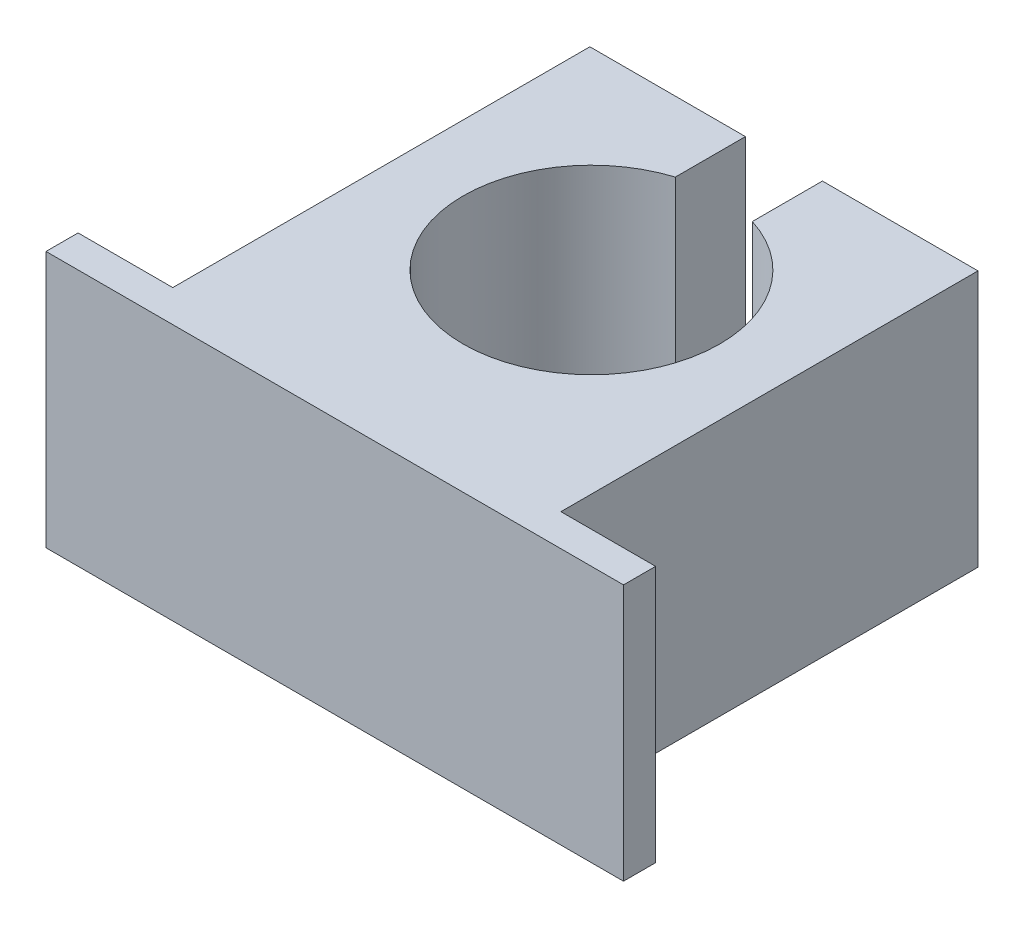
from build123d import *

# Parameters (mm, degrees)
SKETCH1_W           = 90
SKETCH1_H           = 70
BOSS_EXTRUDE1_DEPTH = 40
SKETCH4_R           = 20
CUT_EXTRUDE1_DEPTH  = 40
SKETCH5_W           = 14.755351209
SKETCH5_H           = 65
CUT_EXTRUDE2_DEPTH  = 40
SKETCH6_W           = 12
SKETCH6_H           = 27.02325336
CUT_EXTRUDE3_DEPTH  = 40


with BuildPart() as part:
    # Sketch1 → Boss-Extrude1 (new body)
    with BuildSketch(Plane(origin=(0, 0, 0), x_dir=(1, 0, 0), z_dir=(0, 1, 0))):
        Rectangle(SKETCH1_W, SKETCH1_H)
    extrude(amount=BOSS_EXTRUDE1_DEPTH)

    # Sketch4 → Cut-Extrude1 (cut)
    with BuildSketch(Plane(origin=(0, 40, 0), x_dir=(1, 0, 0), z_dir=(0, 1, 0))):
        with Locations(Location((0, 5, 0), (0, 0, 270))):
            Circle(SKETCH4_R)
    extrude(amount=-CUT_EXTRUDE1_DEPTH, mode=Mode.SUBTRACT)

    # Sketch5 → Cut-Extrude2 (cut)
    with BuildSketch(Plane(origin=(0, 40, 0), x_dir=(1, 0, 0), z_dir=(0, 1, 0))):
        with Locations((-37.622324396, 2.5)):
            Rectangle(SKETCH5_W, SKETCH5_H)
        with Locations((37.622324396, 2.5)):
            Rectangle(SKETCH5_W, SKETCH5_H)
    extrude(amount=-CUT_EXTRUDE2_DEPTH, mode=Mode.SUBTRACT)

    # Sketch6 → Cut-Extrude3 (cut)
    with BuildSketch(Plane(origin=(0, 40, 0), x_dir=(1, 0, 0), z_dir=(0, 1, 0))):
        with Locations((0, 35)):
            Rectangle(SKETCH6_W, SKETCH6_H)
    extrude(amount=-CUT_EXTRUDE3_DEPTH, mode=Mode.SUBTRACT)


solid = part.part
